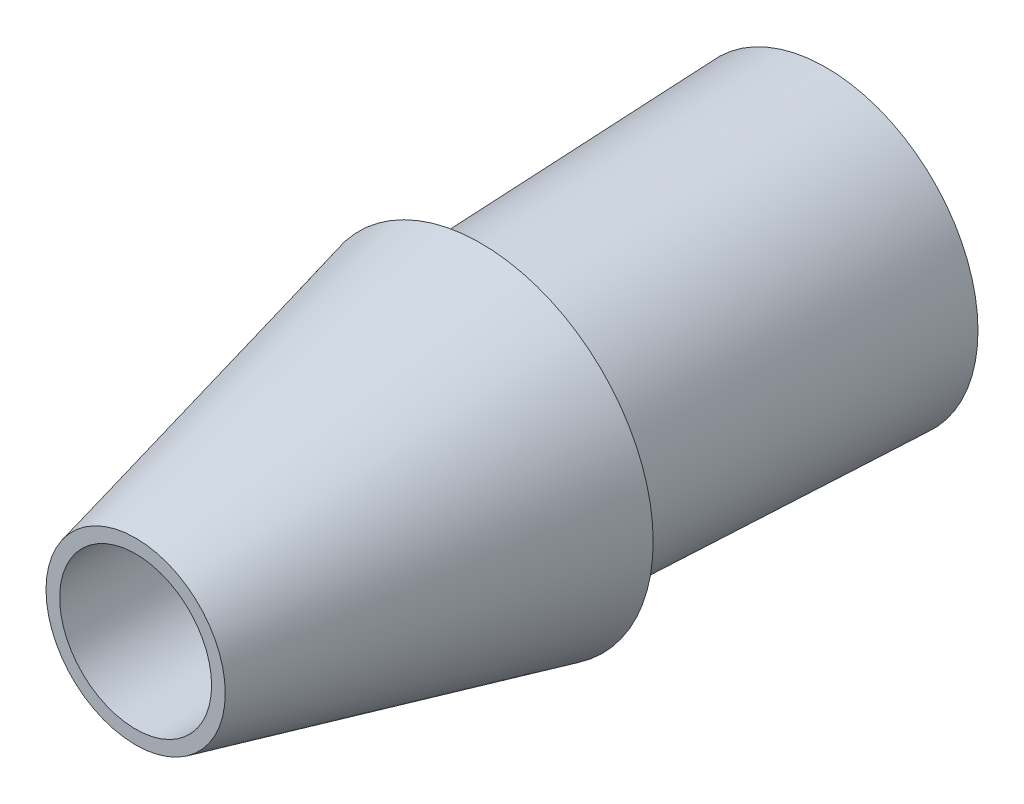
from build123d import *

# Parameters (mm, degrees)
SKETCH1_R          = 1.1
SKETCH2_R          = 1.00380867
SKETCH3_R          = 0.903642253
CUT_EXTRUDE1_DEPTH = 10
SKETCH4_R          = 1.247910004
SKETCH5_R          = 0.649038453
SKETCH6_R          = 0.55
CUT_EXTRUDE2_DEPTH = 10


with BuildPart() as part:
    # Sketch1 → Loft1 section 0
    with BuildSketch(Plane.XY):
        Circle(SKETCH1_R)
    # Sketch2 → Loft1 section 1
    with BuildSketch(Plane.XY.offset(2.5)):
        Circle(SKETCH2_R)
    loft()

    # Sketch3 → Cut-Extrude1 (cut)
    with BuildSketch(Plane.XY.offset(2.5)):
        Circle(SKETCH3_R)
    extrude(amount=-CUT_EXTRUDE1_DEPTH, mode=Mode.SUBTRACT)

    # Sketch4 → Loft2 section 0
    with BuildSketch(Plane.XY.offset(2.5)):
        Circle(SKETCH4_R)
    # Sketch5 → Loft2 section 1
    with BuildSketch(Plane.XY.offset(5)):
        Circle(SKETCH5_R)
    loft()

    # Sketch6 → Cut-Extrude2 (cut)
    with BuildSketch(Plane.XY.offset(5)):
        Circle(SKETCH6_R)
    extrude(amount=-CUT_EXTRUDE2_DEPTH, mode=Mode.SUBTRACT)


solid = part.part
